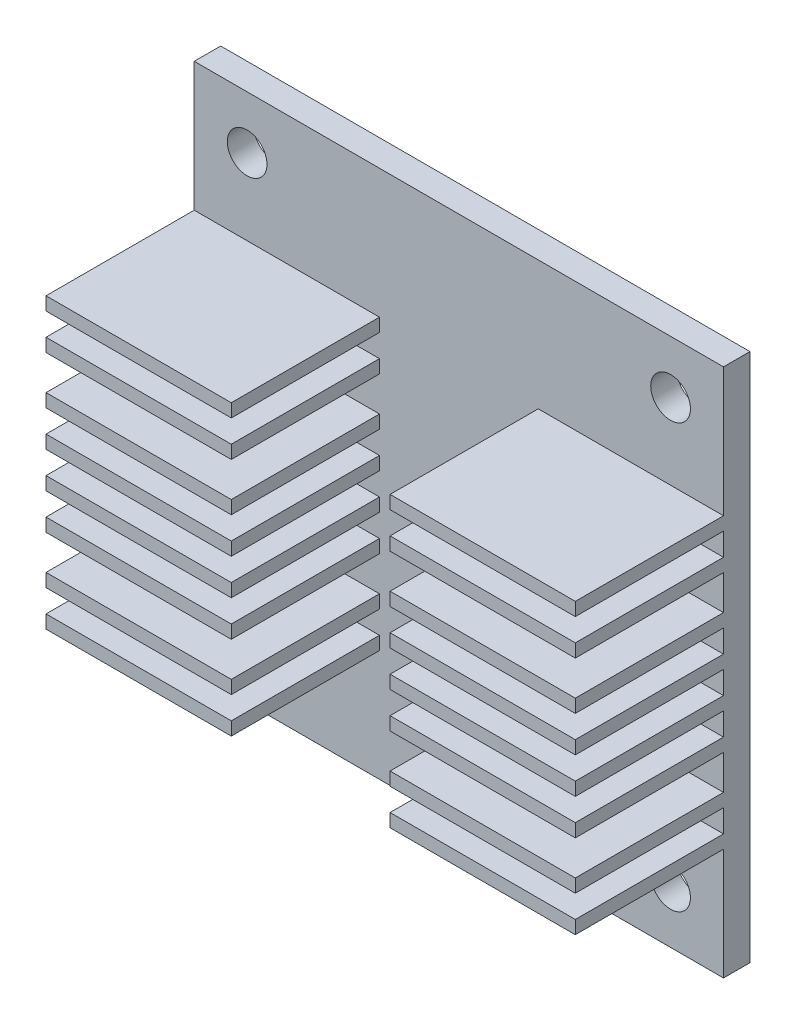
from build123d import *

# Parameters (mm, degrees)
SKETCH1_W            = 40
SKETCH1_H            = 40
BOSS_EXTRUDE1_DEPTH  = 2
EXTRUDE_THIN1_START  = 2
SKETCH1_3_W          = 14
SKETCH1_3_H          = 1
EXTRUDE_THIN1_DEPTH  = 11.2
SKETCH3_R            = 1.5
CUT_EXTRUDE1_DEPTH   = 13.2
LPATTERN1_COUNT      = 2
LPATTERN1_PITCH      = 32
LPATTERN1_COUNT_DIR2 = 2
LPATTERN1_PITCH_DIR2 = 32


with BuildPart() as part:
    # Sketch1 → Boss-Extrude1 (new body)
    with BuildSketch(Plane.XY):
        with Locations((21, 22.483732861)):
            Rectangle(SKETCH1_W, SKETCH1_H)
    extrude(amount=BOSS_EXTRUDE1_DEPTH)

    # Sketch1<3> → Extrude-Thin1 (add)
    with BuildSketch(Plane.XY.offset(EXTRUDE_THIN1_START)):
        with Locations((34, 11.415311808)):
            Rectangle(SKETCH1_3_W, SKETCH1_3_H)
        with Locations((34, 14.131101282)):
            Rectangle(SKETCH1_3_W, SKETCH1_3_H)
        with Locations((34, 17.752153914)):
            Rectangle(SKETCH1_3_W, SKETCH1_3_H)
        with Locations((34, 20.467943387)):
            Rectangle(SKETCH1_3_W, SKETCH1_3_H)
        with Locations((34, 23.183732861)):
            Rectangle(SKETCH1_3_W, SKETCH1_3_H)
        with Locations((34, 25.899522335)):
            Rectangle(SKETCH1_3_W, SKETCH1_3_H)
        with Locations((34, 29.520574966)):
            Rectangle(SKETCH1_3_W, SKETCH1_3_H)
        with Locations((34, 32.23636444)):
            Rectangle(SKETCH1_3_W, SKETCH1_3_H)
        with Locations((8, 11.415311808)):
            Rectangle(SKETCH1_3_W, SKETCH1_3_H)
        with Locations((8, 14.131101282)):
            Rectangle(SKETCH1_3_W, SKETCH1_3_H)
        with Locations((8, 17.752153914)):
            Rectangle(SKETCH1_3_W, SKETCH1_3_H)
        with Locations((8, 20.467943387)):
            Rectangle(SKETCH1_3_W, SKETCH1_3_H)
        with Locations((8, 23.183732861)):
            Rectangle(SKETCH1_3_W, SKETCH1_3_H)
        with Locations((8, 25.899522335)):
            Rectangle(SKETCH1_3_W, SKETCH1_3_H)
        with Locations((8, 29.520574966)):
            Rectangle(SKETCH1_3_W, SKETCH1_3_H)
        with Locations((8, 32.23636444)):
            Rectangle(SKETCH1_3_W, SKETCH1_3_H)
    extrude(amount=EXTRUDE_THIN1_DEPTH)

    # Sketch3 → Cut-Extrude1 (cut)
    with BuildSketch(Plane(origin=(0, 0, 0), x_dir=(-1, 0, 0), z_dir=(0, 0, -1))):
        with Locations((-37, 6.483732861)):
            Circle(SKETCH3_R)
    cut_extrude1 = extrude(amount=-CUT_EXTRUDE1_DEPTH, mode=Mode.SUBTRACT)

    # LPattern1: Cut-Extrude1 2 × 2
    with Locations(*[(-i * LPATTERN1_PITCH, j * LPATTERN1_PITCH_DIR2, 0) for i in range(LPATTERN1_COUNT) for j in range(LPATTERN1_COUNT_DIR2) if (i, j) != (0, 0)]):
        add(cut_extrude1, mode=Mode.SUBTRACT)


solid = part.part
